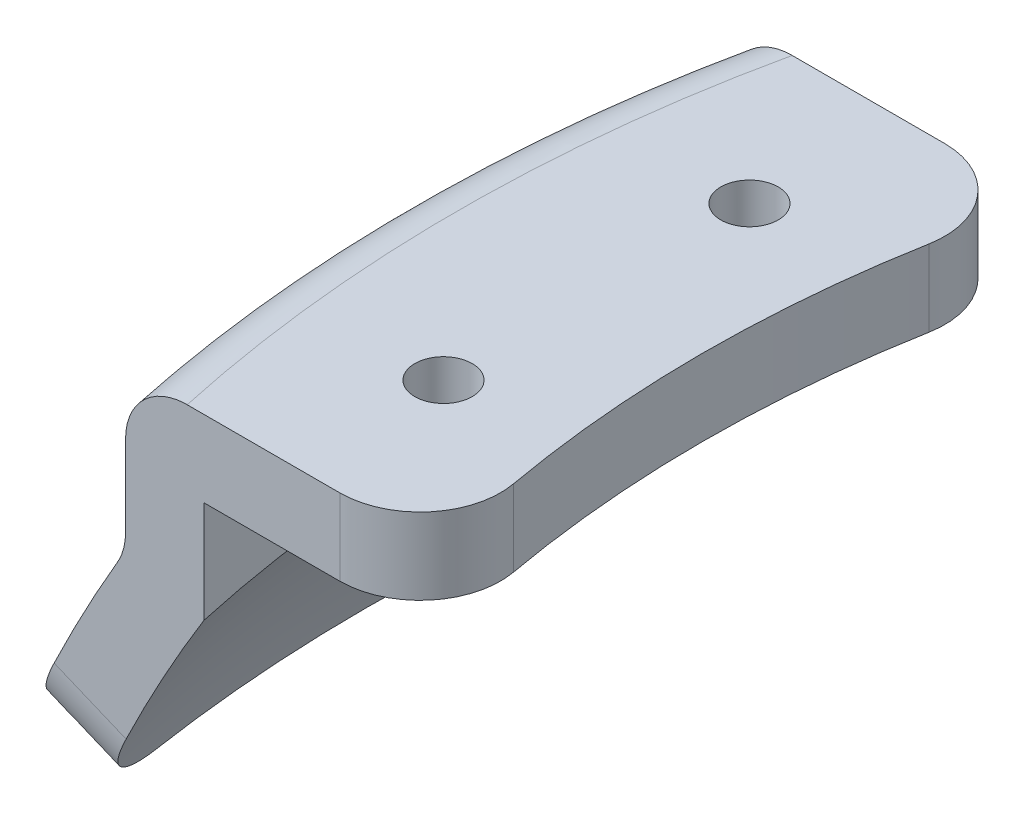
from build123d import *

# Parameters (mm, degrees)
REVOLVE1_ANGLE          = 30
FILLET1_R               = 7.5
CUT_EXTRUDE1_DEPTH      = 207.295163461
CUT_EXTRUDE1_DEPTH_BACK = 207.295163461
SKETCH3_R               = 3.571875
SKETCH4_OUTSIDE_W       = 82.664
SKETCH4_OUTSIDE_H       = 128.62
SKETCH4_OUTSIDE_W_2     = 74.859969382
SKETCH4_OUTSIDE_H_2     = 75.329921726
CUT_EXTRUDE2_DEPTH      = 209.298230862
FILLET2_R               = 10


with BuildPart() as part:
    # Sketch2 → Revolve1 (revolve, symmetric)
    with BuildSketch(Plane.XY) as revolve1_sk:
        with BuildLine():
            Line((-196.144484664, 171.227986779), (-187.361895799, 167.541286653))
            ThreePointArc((-187.361895799, 167.541286653), (-181.203221282, 180.846197706), (-174.101233777, 193.672409282))
            Line((-174.101233777, 193.672409282), (-174.101233777, 206.372409282))
            Line((-174.101233777, 206.372409282), (-145.526233777, 206.372409282))
            Line((-145.526233777, 206.372409282), (-145.526233777, 215.897409282))
            Line((-145.526233777, 215.897409282), (-183.626233777, 215.897409282))
            Line((-183.626233777, 215.897409282), (-183.626233777, 196.285035224))
            ThreePointArc((-183.626233777, 196.285035224), (-190.298222707, 183.962773472), (-196.144484664, 171.227986779))
        make_face()
    revolve(axis=Axis((0, 0, 0), (0, 1, 0)), revolution_arc=REVOLVE1_ANGLE / 2)
    revolve(revolve1_sk.sketch, axis=Axis((0, 0, 0), (0, -1, 0)), revolution_arc=REVOLVE1_ANGLE / 2)

    # Fillet1
    fillet1_edges = [part.edges().sort_by_distance(p)[0] for p in [
        (-183.626233777, 196.285035224, 0),
        (-183.626233777, 215.897409282, 0),
    ]]
    fillet(fillet1_edges, radius=FILLET1_R)

    # Sketch3 → Cut-Extrude1 (cut, two sides: drawn at the far end of the back side and taken through both)
    with BuildSketch(Plane.XZ.offset(-206.372409282).offset(-CUT_EXTRUDE1_DEPTH_BACK)):
        with Locations(Location((-158.75, 19.05, 0), (0, 0, 270))):
            Circle(SKETCH3_R)
        with Locations(Location((-158.75, -19.05, 0), (0, 0, 270))):
            Circle(SKETCH3_R)
    extrude(amount=CUT_EXTRUDE1_DEPTH + CUT_EXTRUDE1_DEPTH_BACK, mode=Mode.SUBTRACT)

    # Sketch4 outside → Cut-Extrude2 (cut, through all)
    with BuildSketch(Plane(origin=(0, 215.897409282, 0), x_dir=(1, 0, 0), z_dir=(0, 1, 0))):
        with Locations((-168.356, 0)):
            Rectangle(SKETCH4_OUTSIDE_W, SKETCH4_OUTSIDE_H)
        with Locations((-177.997532298, 0)):
            Rectangle(SKETCH4_OUTSIDE_W_2, SKETCH4_OUTSIDE_H_2, mode=Mode.SUBTRACT)
    extrude(amount=-CUT_EXTRUDE2_DEPTH, mode=Mode.SUBTRACT)

    # Fillet2
    fillet2_edges = [part.edges().sort_by_distance(p)[0] for p in [
        (-140.567547607, 211.134909282, 37.664960863),
        (-188.015889107, 169.383911967, 37.664960863),
        (-188.015889107, 169.383911967, -37.664960863),
        (-140.567547607, 211.134909282, -37.664960863),
    ]]
    fillet(fillet2_edges, radius=FILLET2_R)


solid = part.part
